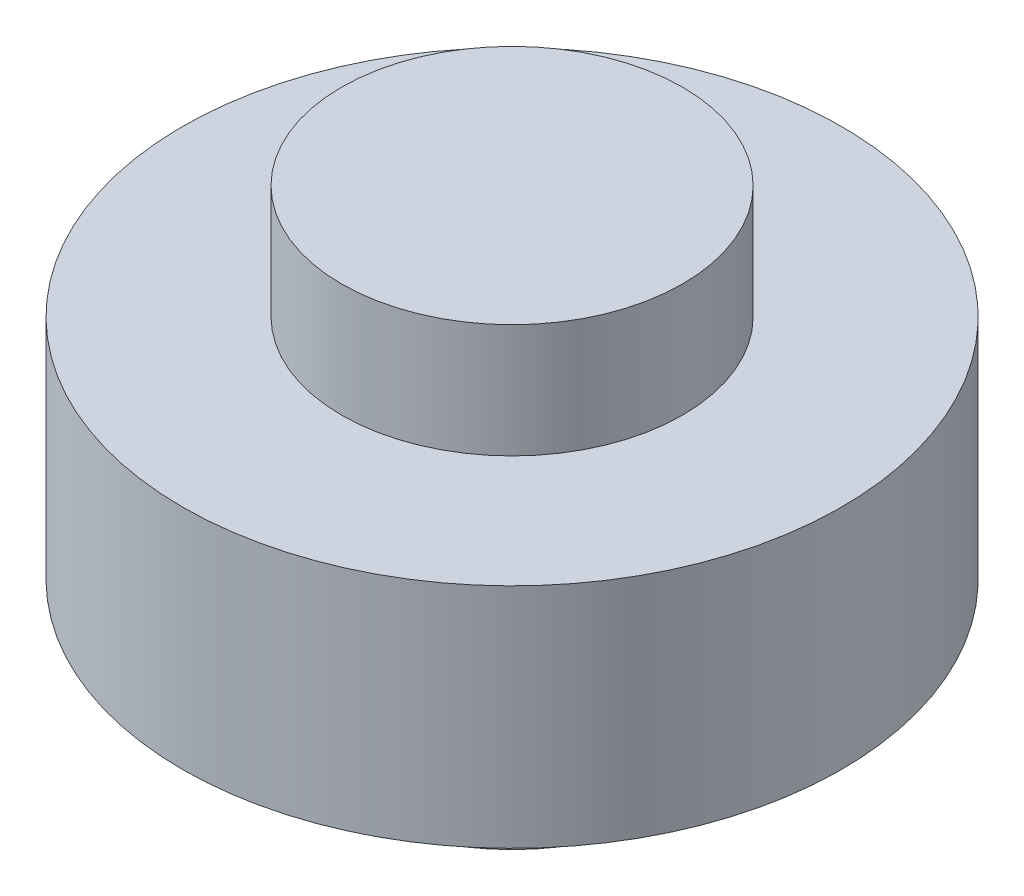
from build123d import *


with BuildPart() as part:
    # Sketch1 → Revolve1 (revolve)
    with BuildSketch(Plane.XY, mode=Mode.PRIVATE) as revolve1_sk:
        Polygon((0, 101.6), (0, -101.6), (-76.2, -101.6), (-76.2, -50.8), (-147.32, -50.8), (-147.32, 50.8), (-76.2, 50.8), (-76.2, 101.6), align=None)
    revolve(revolve1_sk.sketch.rotate(Axis((0, 101.6, 0), (0, -1, 0)), 270), axis=Axis((0, 101.6, 0), (0, -1, 0)))


solid = part.part
